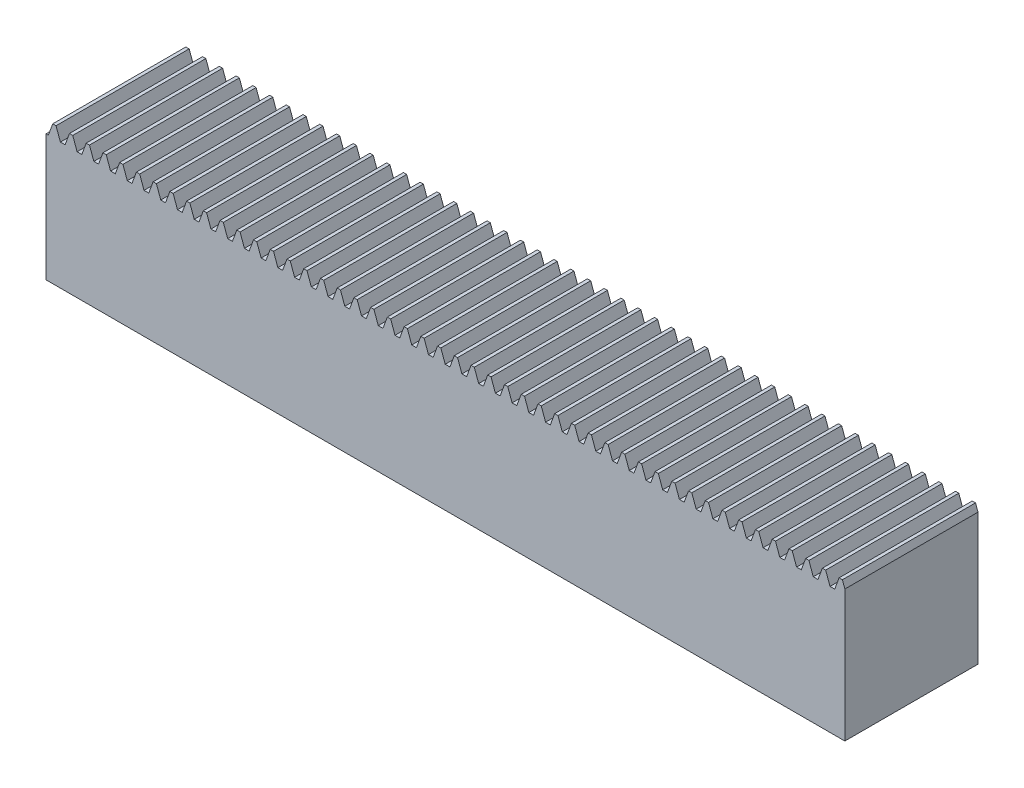
from build123d import *

# Parameters (mm, degrees)
BLANKSKE_W        = 60
BLANKSKE_H        = 10.4
BLANK_DEPTH       = 10
TOOTHCUTSIM_DEPTH = 62.710290876
TEETHCUTS_COUNT   = 49
TEETHCUTS_PITCH   = 1.25663706


with BuildPart() as part:
    # BlankSke → Blank (new body)
    with BuildSketch(Plane.XY):
        with Locations((30, 5.2)):
            Rectangle(BLANKSKE_W, BLANKSKE_H)
    extrude(amount=-BLANK_DEPTH)

    # TooCutSkeSim → ToothCutSim (cut, through all)
    with BuildSketch(Plane.XY):
        Polygon((0.177174148, 9.5), (-0.177174148, 9.5), (-0.513992203, 10.4254), (0.513992203, 10.4254), align=None)
    toothcutsim = extrude(amount=-TOOTHCUTSIM_DEPTH, mode=Mode.SUBTRACT)

    # TeethCuts: ToothCutSim ×49
    with Locations(*[(i * TEETHCUTS_PITCH, 0, 0) for i in range(1, TEETHCUTS_COUNT)]):
        add(toothcutsim, mode=Mode.SUBTRACT)


solid = part.part
